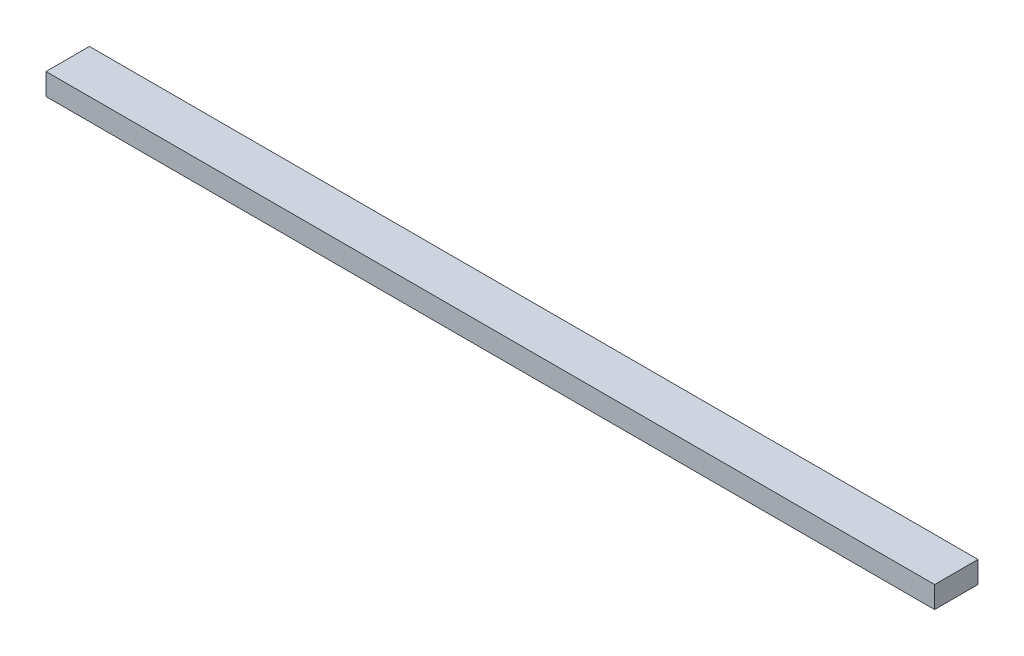
from build123d import *

# Parameters (mm, degrees)
BOSS_EXTRUDE1_DEPTH      = 65
BOSS_EXTRUDE1_DEPTH_BACK = 65
SKETCH3_W                = 6.35
SKETCH3_H                = 3.175


with BuildPart() as part:
    # Sketch3 → Boss-Extrude1 (new, two sides: drawn at the far end of the back side and taken through both)
    with BuildSketch(Plane(origin=(0, 0, 0), x_dir=(0, 0, -1), z_dir=(1, 0, 0)).offset(-BOSS_EXTRUDE1_DEPTH_BACK)):
        Rectangle(SKETCH3_W, SKETCH3_H)
    extrude(amount=BOSS_EXTRUDE1_DEPTH + BOSS_EXTRUDE1_DEPTH_BACK)


solid = part.part
